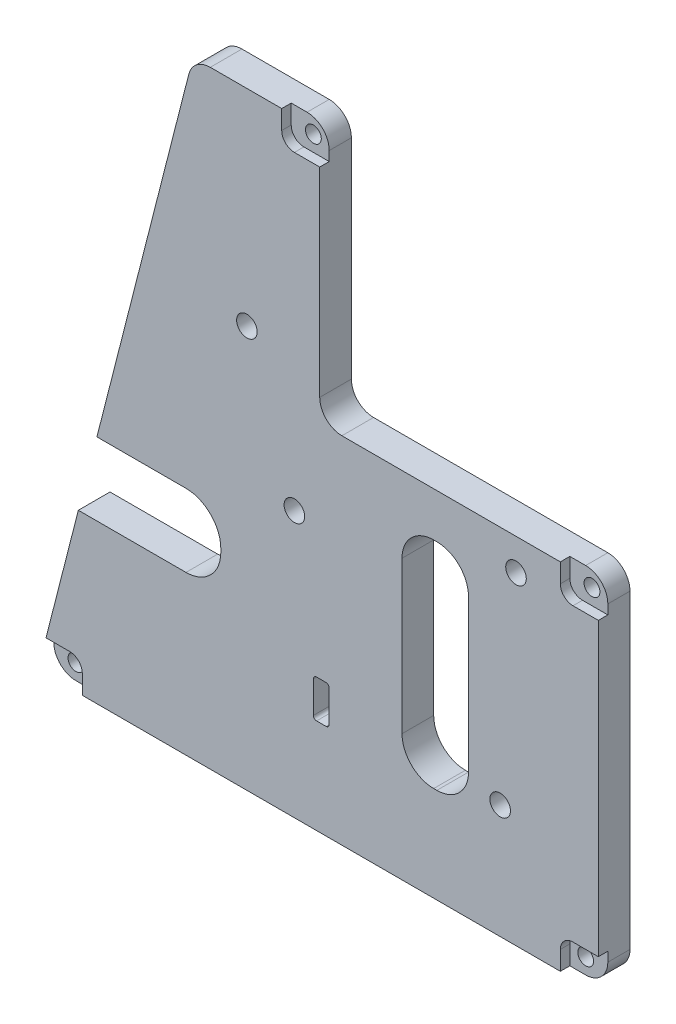
from build123d import *

# Parameters (mm, degrees)
BOSS_EXTRUDE1_DEPTH = 10
CUT_EXTRUDE1_DEPTH  = 10
SKETCH3_R           = 3.25
CUT_EXTRUDE2_DEPTH  = 10
CUT_EXTRUDE3_DEPTH  = 3
SKETCH5_R           = 2.5
CUT_EXTRUDE4_DEPTH  = 7


with BuildPart() as part:
    # Sketch1 → Boss-Extrude1 (new body)
    with BuildSketch(Plane.XY):
        with BuildLine():
            Line((89.21038961, -16.914285714), (15.21038961, -16.914285714))
            ThreePointArc((15.21038961, -16.914285714), (10.260642142, -14.864033183), (8.21038961, -9.914285714))
            Line((8.21038961, -9.914285714), (8.21038961, 56.085714286))
            ThreePointArc((8.21038961, 56.085714286), (6.160137079, 61.035461754), (1.21038961, 63.085714286))
            Line((1.21038961, 63.085714286), (-26.351704849, 63.085714286))
            ThreePointArc((-26.351704849, 63.085714286), (-30.646070949, 61.613681345), (-33.134308946, 57.816691373))
            Line((-33.134308946, 57.816691373), (-78.561392279, -120.183308627))
            ThreePointArc((-78.561392279, -120.183308627), (-77.306755242, -126.208651814), (-71.778788183, -128.914285714))
            Line((-71.778788183, -128.914285714), (89.21038961, -128.914285714))
            ThreePointArc((89.21038961, -128.914285714), (94.160137079, -126.864033183), (96.21038961, -121.914285714))
            Line((96.21038961, -121.914285714), (96.21038961, -23.914285714))
            ThreePointArc((96.21038961, -23.914285714), (94.160137079, -18.964538246), (89.21038961, -16.914285714))
        make_face()
    extrude(amount=BOSS_EXTRUDE1_DEPTH)

    # Sketch2 → Cut-Extrude1 (cut)
    with BuildSketch(Plane.XY.offset(10)):
        with BuildLine():
            Line((-68.029193723, -55.914285714), (-34.029193723, -55.914285714))
            ThreePointArc((-34.029193723, -55.914285714), (-26.25101913, -59.136111121), (-23.029193723, -66.914285714))
            Line((-23.029193723, -66.914285714), (-23.029193723, -67.914285714))
            ThreePointArc((-23.029193723, -67.914285714), (-26.25101913, -75.692460307), (-34.029193723, -78.914285714))
            Line((-34.029193723, -78.914285714), (-68.029193723, -78.914285714))
            Line((-68.029193723, -78.914285714), (-68.029193723, -55.914285714))
        make_face()
    extrude(amount=-CUT_EXTRUDE1_DEPTH, mode=Mode.SUBTRACT)

    # Sketch3 → Cut-Extrude2 (cut)
    with BuildSketch(Plane.XY.offset(10)):
        with Locations((-14.78961039, -1.914285714)):
            Circle(SKETCH3_R)
        with Locations((0.21038961, -44.914285714)):
            Circle(SKETCH3_R)
        with Locations((70.21038961, -26.914285714)):
            Circle(SKETCH3_R)
        with Locations((65.21038961, -92.914285714)):
            Circle(SKETCH3_R)
        with BuildLine():
            Line((7.21038961, -86.914285714), (10.21038961, -86.914285714))
            ThreePointArc((10.21038961, -86.914285714), (10.917496392, -87.207178933), (11.21038961, -87.914285714))
            Line((11.21038961, -87.914285714), (11.21038961, -97.914285714))
            ThreePointArc((11.21038961, -97.914285714), (10.917496392, -98.621392495), (10.21038961, -98.914285714))
            Line((10.21038961, -98.914285714), (7.21038961, -98.914285714))
            ThreePointArc((7.21038961, -98.914285714), (6.503282829, -98.621392495), (6.21038961, -97.914285714))
            Line((6.21038961, -97.914285714), (6.21038961, -87.914285714))
            ThreePointArc((6.21038961, -87.914285714), (6.503282829, -87.207178933), (7.21038961, -86.914285714))
        make_face()
        with BuildLine():
            Line((44.21038961, -30.914285714), (45.21038961, -30.914285714))
            ThreePointArc((45.21038961, -30.914285714), (52.281457422, -33.843217902), (55.21038961, -40.914285714))
            Line((55.21038961, -40.914285714), (55.21038961, -88.914285714))
            ThreePointArc((55.21038961, -88.914285714), (52.281457422, -95.985353526), (45.21038961, -98.914285714))
            Line((45.21038961, -98.914285714), (44.21038961, -98.914285714))
            ThreePointArc((44.21038961, -98.914285714), (37.139321799, -95.985353526), (34.21038961, -88.914285714))
            Line((34.21038961, -88.914285714), (34.21038961, -40.914285714))
            ThreePointArc((34.21038961, -40.914285714), (37.139321799, -33.843217902), (44.21038961, -30.914285714))
        make_face()
    extrude(amount=-CUT_EXTRUDE2_DEPTH, mode=Mode.SUBTRACT)

    # Sketch4 → Cut-Extrude3 (cut)
    with BuildSketch(Plane.XY.offset(10)):
        with BuildLine():
            Line((96.21038961, -118.914285714), (88.21038961, -118.914285714))
            ThreePointArc((88.21038961, -118.914285714), (85.381962486, -120.08585859), (84.21038961, -122.914285714))
            Line((84.21038961, -122.914285714), (84.21038961, -128.914285714))
            Line((84.21038961, -128.914285714), (96.21038961, -128.914285714))
            Line((96.21038961, -128.914285714), (96.21038961, -118.914285714))
        make_face()
        with BuildLine():
            Line((-66.778788183, -128.914285714), (-78.778788183, -128.914285714))
            Line((-78.778788183, -128.914285714), (-78.778788183, -118.914285714))
            Line((-78.778788183, -118.914285714), (-70.778788183, -118.914285714))
            ThreePointArc((-70.778788183, -118.914285714), (-67.950361058, -120.08585859), (-66.778788183, -122.914285714))
            Line((-66.778788183, -122.914285714), (-66.778788183, -128.914285714))
        make_face()
        with BuildLine():
            Line((84.21038961, -16.914285714), (96.21038961, -16.914285714))
            Line((96.21038961, -16.914285714), (96.21038961, -26.914285714))
            Line((96.21038961, -26.914285714), (88.21038961, -26.914285714))
            ThreePointArc((88.21038961, -26.914285714), (85.381962486, -25.742712839), (84.21038961, -22.914285714))
            Line((84.21038961, -22.914285714), (84.21038961, -16.914285714))
        make_face()
        with BuildLine():
            Line((-3.78961039, 63.085714286), (8.21038961, 63.085714286))
            Line((8.21038961, 63.085714286), (8.21038961, 53.085714286))
            Line((8.21038961, 53.085714286), (0.21038961, 53.085714286))
            ThreePointArc((0.21038961, 53.085714286), (-2.618037514, 54.257287161), (-3.78961039, 57.085714286))
            Line((-3.78961039, 57.085714286), (-3.78961039, 63.085714286))
        make_face()
    extrude(amount=-CUT_EXTRUDE3_DEPTH, mode=Mode.SUBTRACT)

    # Sketch5 → Cut-Extrude4 (cut)
    with BuildSketch(Plane.XY.offset(7)):
        with Locations((-71.778788183, -123.914285714)):
            Circle(SKETCH5_R)
        with Locations((89.21038961, -123.914285714)):
            Circle(SKETCH5_R)
        with Locations((91.21038961, -21.914285714)):
            Circle(SKETCH5_R)
        with Locations((3.21038961, 58.085714286)):
            Circle(SKETCH5_R)
    extrude(amount=-CUT_EXTRUDE4_DEPTH, mode=Mode.SUBTRACT)


solid = part.part
